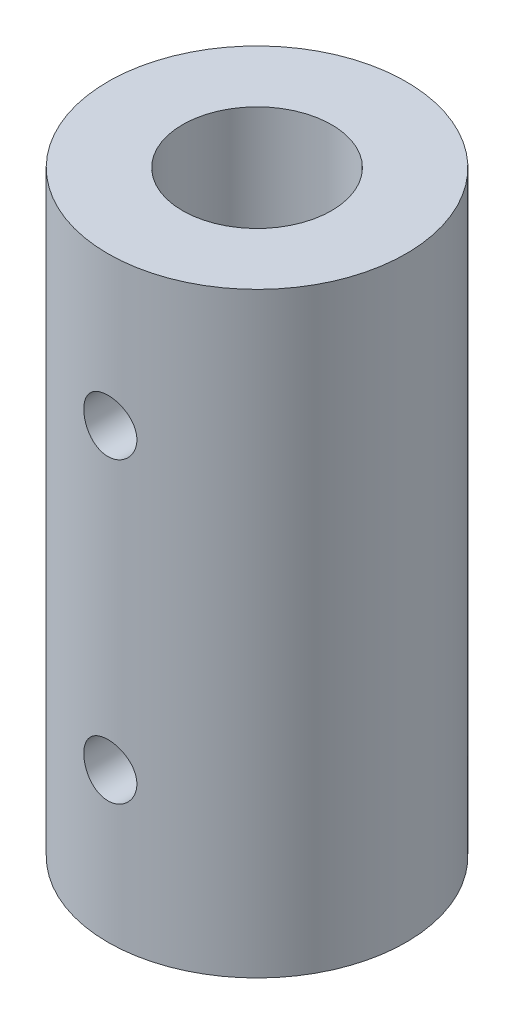
from build123d import *

# Parameters (mm, degrees)
SKETCH1_R               = 6.35
BOSS_EXTRUDE1_DEPTH     = 25.4
CUT_EXTRUDE2_DEPTH      = 27.940768363
CUT_EXTRUDE2_DEPTH_BACK = 12.7
SKETCH3_R               = 4
SKETCH6_R               = 4.0005
CUT_EXTRUDE5_DEPTH      = 12.7
SKETCH4_R               = 1.1303
CUT_EXTRUDE3_DEPTH      = 6.35
SKETCH7_R               = 3.175
CUT_EXTRUDE6_DEPTH      = 12.7


with BuildPart() as part:
    # Sketch1 → Boss-Extrude1 (new body)
    with BuildSketch(Plane(origin=(0, 0, 0), x_dir=(1, 0, 0), z_dir=(0, 1, 0))):
        with Locations(Location((0, 0, 0), (0, 0, 270))):
            Circle(SKETCH1_R)
    extrude(amount=BOSS_EXTRUDE1_DEPTH)

    # Sketch3 → Cut-Extrude2 (cut, two sides: drawn at the far end of the back side and taken through both)
    with BuildSketch(Plane.XZ.offset(-CUT_EXTRUDE2_DEPTH_BACK)):
        with Locations(Location((0, 0, 0), (0, 0, 90))):
            Circle(SKETCH3_R)
    extrude(amount=CUT_EXTRUDE2_DEPTH + CUT_EXTRUDE2_DEPTH_BACK, mode=Mode.SUBTRACT)

    # Sketch6 → Cut-Extrude5 (cut)
    with BuildSketch(Plane(origin=(0, 0, 0), x_dir=(-1, 0, 0), z_dir=(0, -1, 0))):
        with Locations(Location((0, 0, 0), (0, 0, 90))):
            Circle(SKETCH6_R)
    extrude(amount=-CUT_EXTRUDE5_DEPTH, mode=Mode.SUBTRACT)

    # Sketch4 → Cut-Extrude3 (cut)
    with BuildSketch(Plane.XY.offset(6.35)):
        with Locations((0, 6.35)):
            Circle(SKETCH4_R)
        with Locations((0, 19.05)):
            Circle(SKETCH4_R)
    extrude(amount=-CUT_EXTRUDE3_DEPTH, mode=Mode.SUBTRACT)

    # Sketch7 → Cut-Extrude6 (cut)
    with BuildSketch(Plane(origin=(0, 25.4, 0), x_dir=(1, 0, 0), z_dir=(0, 1, 0))):
        with Locations(Location((0, 0, 0), (0, 0, 270))):
            Circle(SKETCH7_R)
    extrude(amount=-CUT_EXTRUDE6_DEPTH, mode=Mode.SUBTRACT)


solid = part.part
